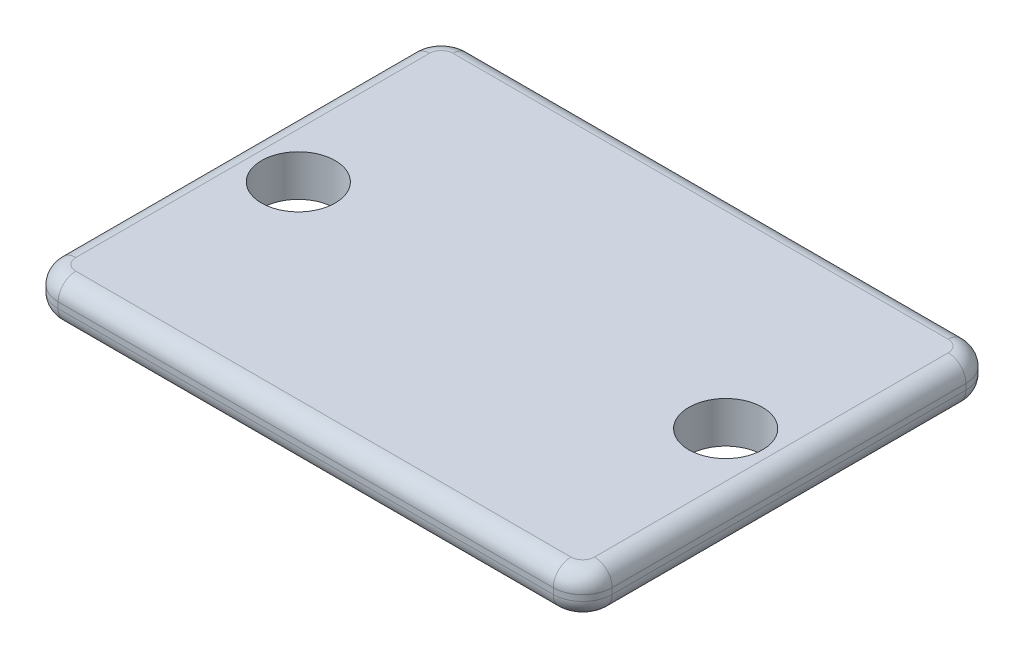
from build123d import *

# Parameters (mm, degrees)
SKETCH1_W                 = 18.8
SKETCH1_H                 = 14
SKETCH1_R                 = 1.25
CABLE_PLATE_EXTRUDE_DEPTH = 1.4
FILLET2_R                 = 1
FILLET1_R                 = 0.6


with BuildPart() as part:
    # Sketch1 → Cable Plate Extrude (new body)
    with BuildSketch(Plane(origin=(0, 0, 0), x_dir=(1, 0, 0), z_dir=(0, 1, 0))):
        Rectangle(SKETCH1_W, SKETCH1_H)
        with Locations(Location((-7.25, 0, 0), (0, 0, 270))):
            Circle(SKETCH1_R, mode=Mode.SUBTRACT)
        with Locations(Location((7.25, 0, 0), (0, 0, 270))):
            Circle(SKETCH1_R, mode=Mode.SUBTRACT)
    extrude(amount=CABLE_PLATE_EXTRUDE_DEPTH)

    # Fillet2
    fillet2_edges = [part.edges().sort_by_distance(p)[0] for p in [
        (-9.4, 0.7, -7),
        (9.4, 0.7, -7),
        (9.4, 0.7, 7),
        (-9.4, 0.7, 7),
    ]]
    fillet(fillet2_edges, radius=FILLET2_R)

    # Fillet1
    fillet1_edges = [part.edges().sort_by_distance(p)[0] for p in [
        (0, 0, 7),
        (0, 1.4, 7),
        (-9.4, 0, 0),
        (0, 0, -7),
        (9.4, 0, 0),
        (-9.107106781, 0, -6.707106781),
        (9.107106781, 0, -6.707106781),
        (9.107106781, 0, 6.707106781),
        (-9.107106781, 0, 6.707106781),
        (-9.4, 1.4, 0),
        (9.4, 1.4, 0),
        (0, 1.4, -7),
        (-9.107106781, 1.4, -6.707106781),
        (9.107106781, 1.4, -6.707106781),
        (9.107106781, 1.4, 6.707106781),
        (-9.107106781, 1.4, 6.707106781),
    ]]
    fillet(fillet1_edges, radius=FILLET1_R)


solid = part.part
